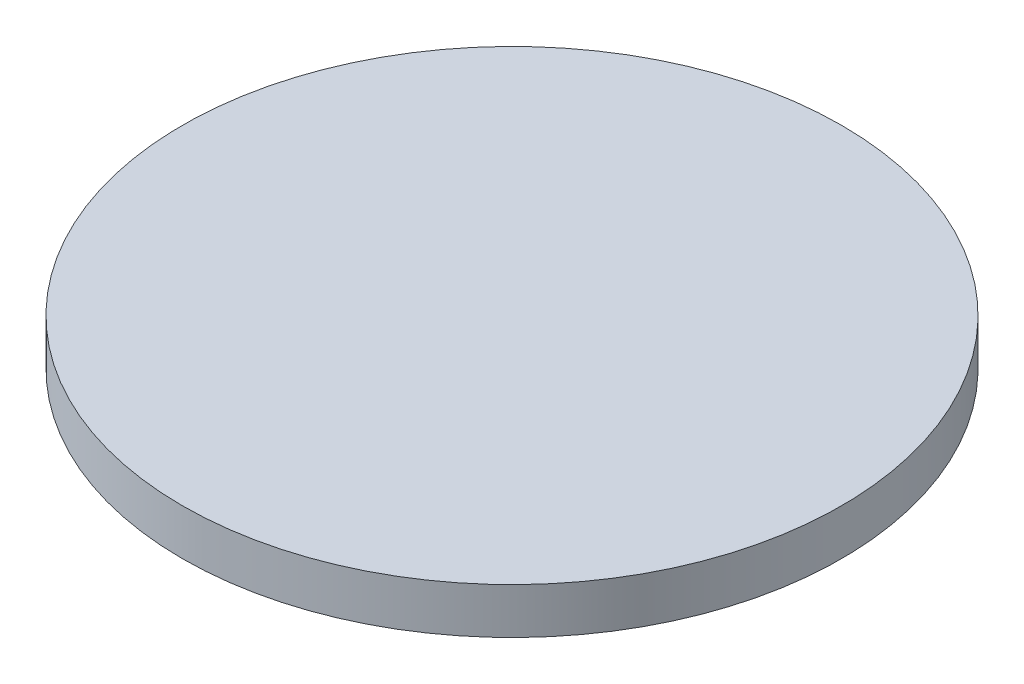
from build123d import *

# Parameters (mm, degrees)
SKETCH1_R           = 11.5
BOSS_EXTRUDE1_DEPTH = 1.6


with BuildPart() as part:
    # Sketch1 → Boss-Extrude1 (new body)
    with BuildSketch(Plane(origin=(0, 0, 0), x_dir=(1, 0, 0), z_dir=(0, 1, 0))):
        with Locations(Location((0, 0, 0), (0, 0, 270))):
            Circle(SKETCH1_R)
    extrude(amount=BOSS_EXTRUDE1_DEPTH)


solid = part.part
